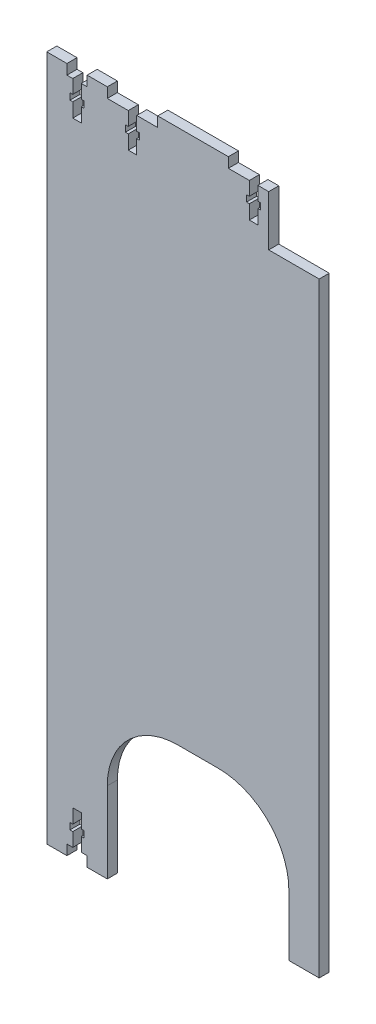
from build123d import *

# Parameters (mm, degrees)
BOSS_EXTRUDE1_DEPTH   = 5
SKETCH1_W             = 35
SKETCH1_H             = 5
BOSS_EXTRUDE1_2_DEPTH = 5
SKETCH2_W             = 56.57205094
SKETCH2_H             = 46.29963395
CUT_EXTRUDE1_DEPTH    = 10
BOSS_EXTRUDE2_DEPTH   = 5
SKETCH4_W             = 15
SKETCH4_H             = 10
CUT_EXTRUDE2_DEPTH    = 5


with BuildPart() as part:
    # Sketch1 → Boss-Extrude1 (new body)
    with BuildSketch(Plane.XY):
        with BuildLine():
            Line((-45, 70), (0, 70))
            Line((0, 70), (0, 330))
            Line((0, 330), (-5.4, 330))
            Line((-5.4, 330), (-5.4, 323.2))
            Line((-5.4, 323.2), (-4, 323.2))
            Line((-4, 323.2), (-4, 320))
            Line((-4, 320), (-5.4, 320))
            Line((-5.4, 320), (-5.4, 313))
            Line((-5.4, 313), (-9.6, 313))
            Line((-9.6, 313), (-9.6, 320))
            Line((-9.6, 320), (-11, 320))
            Line((-11, 320), (-11, 323.2))
            Line((-11, 323.2), (-9.6, 323.2))
            Line((-9.6, 323.2), (-9.6, 330))
            Line((-9.6, 330), (-20, 330))
            Line((-20, 330), (-20, 335))
            Line((-20, 335), (-55, 335))
            Line((-55, 335), (-55, 330))
            Line((-55, 330), (-65.4, 330))
            Line((-65.4, 330), (-65.4, 323.2))
            Line((-65.4, 323.2), (-64, 323.2))
            Line((-64, 323.2), (-64, 320))
            Line((-64, 320), (-65.4, 320))
            Line((-65.4, 320), (-65.4, 313))
            Line((-65.4, 313), (-69.6, 313))
            Line((-69.6, 313), (-69.6, 320))
            Line((-69.6, 320), (-71, 320))
            Line((-71, 320), (-71, 323.2))
            Line((-71, 323.2), (-69.6, 323.2))
            Line((-69.6, 323.2), (-69.6, 330))
            Line((-69.6, 330), (-80, 330))
            Line((-80, 330), (-80, 335))
            Line((-80, 335), (-90, 335))
            Line((-90, 335), (-90, 330))
            Line((-90, 330), (-92.9, 330))
            Line((-92.9, 330), (-92.9, 323.2))
            Line((-92.9, 323.2), (-91.5, 323.2))
            Line((-91.5, 323.2), (-91.5, 320))
            Line((-91.5, 320), (-92.9, 320))
            Line((-92.9, 320), (-92.9, 313))
            Line((-92.9, 313), (-97.1, 313))
            Line((-97.1, 313), (-97.1, 320))
            Line((-97.1, 320), (-98.5, 320))
            Line((-98.5, 320), (-98.5, 323.2))
            Line((-98.5, 323.2), (-97.1, 323.2))
            Line((-97.1, 323.2), (-97.1, 330))
            Line((-97.1, 330), (-100, 330))
            Line((-100, 330), (-100, 335))
            Line((-100, 335), (-110, 335))
            Line((-110, 335), (-110, -5))
            Line((-110, -5), (-100, -5))
            Line((-100, -5), (-100, 0))
            Line((-100, 0), (-97.1, 0))
            Line((-97.1, 0), (-97.1, 6.8))
            Line((-97.1, 6.8), (-98.5, 6.8))
            Line((-98.5, 6.8), (-98.5, 10))
            Line((-98.5, 10), (-97.1, 10))
            Line((-97.1, 10), (-97.1, 17))
            Line((-97.1, 17), (-92.9, 17))
            Line((-92.9, 17), (-92.9, 10))
            Line((-92.9, 10), (-91.5, 10))
            Line((-91.5, 10), (-91.5, 6.8))
            Line((-91.5, 6.8), (-92.9, 6.8))
            Line((-92.9, 6.8), (-92.9, 0))
            Line((-92.9, 0), (-90, 0))
            Line((-90, 0), (-90, -5))
            Line((-90, -5), (-80, -5))
            Line((-80, -5), (-80, 35))
            ThreePointArc((-80, 35), (-69.748737342, 59.748737342), (-45, 70))
        make_face()
    extrude(amount=BOSS_EXTRUDE1_DEPTH)

    # Sketch3 → Boss-Extrude2 (add)
    with BuildSketch(Plane.XY.offset(5)):
        with BuildLine():
            Line((0, 305), (25, 305))
            Line((25, 305), (25, 70))
            Line((25, 70), (25, -5))
            Line((25, -5), (10, -5))
            Line((10, -5), (10, 35))
            ThreePointArc((10, 35), (-0.251262658, 59.748737342), (-25, 70))
            Line((-25, 70), (0, 70))
            Line((0, 70), (0, 305))
        make_face()
    extrude(amount=-BOSS_EXTRUDE2_DEPTH)

    # Sketch4 → Cut-Extrude2 (cut)
    with BuildSketch(Plane.XY.offset(5)):
        with Locations((17.5, 0)):
            Rectangle(SKETCH4_W, SKETCH4_H)
    extrude(amount=-CUT_EXTRUDE2_DEPTH, mode=Mode.SUBTRACT)


with BuildPart() as body_2:
    # Sketch1 → Boss-Extrude1 2 (new body)
    with BuildSketch(Plane.XY):
        with Locations((-37.5, -2.5)):
            Rectangle(SKETCH1_W, SKETCH1_H)
    extrude(amount=BOSS_EXTRUDE1_2_DEPTH)

    # Sketch2 → Cut-Extrude1 (cut)
    with BuildSketch(Plane.XY.offset(5)):
        with Locations((-32.79534341, -6.148476698)):
            Rectangle(SKETCH2_W, SKETCH2_H)
    extrude(amount=-CUT_EXTRUDE1_DEPTH, mode=Mode.SUBTRACT)


solid = part.part
